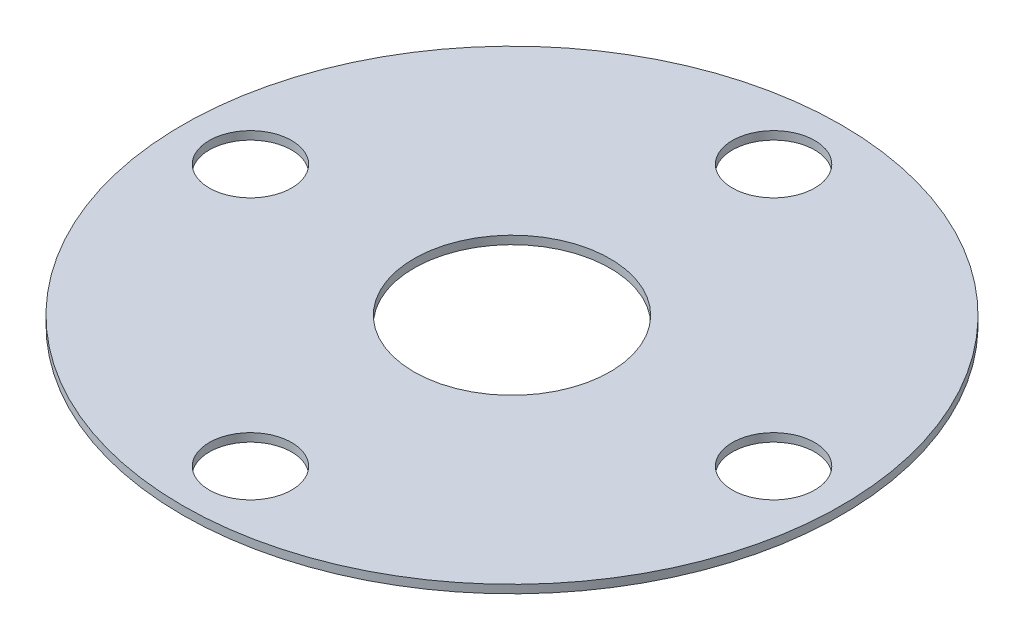
from build123d import *

# Parameters (mm, degrees)
SKETCH1_R           = 32.004
SKETCH1_R_2         = 9.525
SKETCH1_R_3         = 4
BOSS_EXTRUDE1_DEPTH = 0.8


with BuildPart() as part:
    # Sketch1 → Boss-Extrude1 (new body)
    with BuildSketch(Plane(origin=(0, 0, 0), x_dir=(1, 0, 0), z_dir=(0, 1, 0))):
        with Locations(Location((0, 0, 0), (0, 0, 270))):
            Circle(SKETCH1_R)
        with Locations(Location((0, 0, 0), (0, 0, 270))):
            Circle(SKETCH1_R_2, mode=Mode.SUBTRACT)
        with Locations(Location((0, 25.4, 0), (0, 0, 270))):
            Circle(SKETCH1_R_3, mode=Mode.SUBTRACT)
        with Locations(Location((25.4, 0, 0), (0, 0, 270))):
            Circle(SKETCH1_R_3, mode=Mode.SUBTRACT)
        with Locations(Location((0, -25.4, 0), (0, 0, 270))):
            Circle(SKETCH1_R_3, mode=Mode.SUBTRACT)
        with Locations(Location((-25.4, 0, 0), (0, 0, 270))):
            Circle(SKETCH1_R_3, mode=Mode.SUBTRACT)
    extrude(amount=BOSS_EXTRUDE1_DEPTH)


solid = part.part
